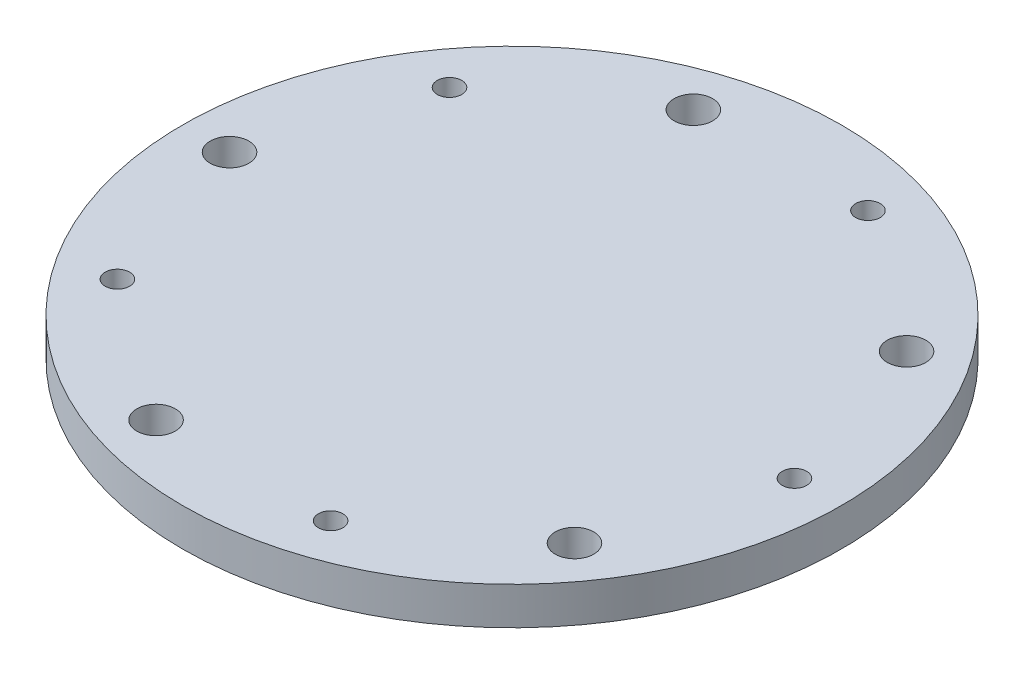
from build123d import *

# Parameters (mm, degrees)
SKETCH19_R          = 70
BOSS_EXTRUDE2_DEPTH = 8
SKETCH19_3_R        = 4.1
SKETCH19_3_R_2      = 2.6
BOLT_HOLES_DEPTH    = 8
CIRPATTERN10_COUNT  = 5


with BuildPart() as part:
    # Sketch1 → Revolve1 (revolve)
    with BuildSketch(Plane.XY, mode=Mode.PRIVATE) as revolve1_sk:
        Polygon((-47.4, 0), (-47.4, -8), (-17.4, -8), (-7, -8), (0, -8), (0, 0), align=None)
    revolve(revolve1_sk.sketch.rotate(Axis((0, -8, 0), (0, 1, 0)), 180), axis=Axis((0, -8, 0), (0, 1, 0)))

    # Sketch19 → Boss-Extrude2 (add)
    with BuildSketch(Plane.XZ.offset(8)):
        with Locations(Location((0, 0, 0), (0, 0, 270))):
            Circle(SKETCH19_R)
    extrude(amount=-BOSS_EXTRUDE2_DEPTH)

    # Sketch19<3> → Bolt holes (cut)
    with BuildSketch(Plane.XZ.offset(8)):
        with Locations(Location((-60, 0, 0), (0, 0, 270))):
            Circle(SKETCH19_3_R)
        with Locations(Location((-48.541019662, -35.267115138, 0), (0, 0, 270))):
            Circle(SKETCH19_3_R_2)
    bolt_holes = extrude(amount=-BOLT_HOLES_DEPTH, mode=Mode.SUBTRACT)

    # CirPattern10: Bolt holes ×5 about axis
    cirpattern10_axis = Axis((0, 0, 0), (0, 1, 0))
    for i in range(1, CIRPATTERN10_COUNT):
        add(bolt_holes.rotate(cirpattern10_axis, i * 360 / CIRPATTERN10_COUNT), mode=Mode.SUBTRACT)


solid = part.part
